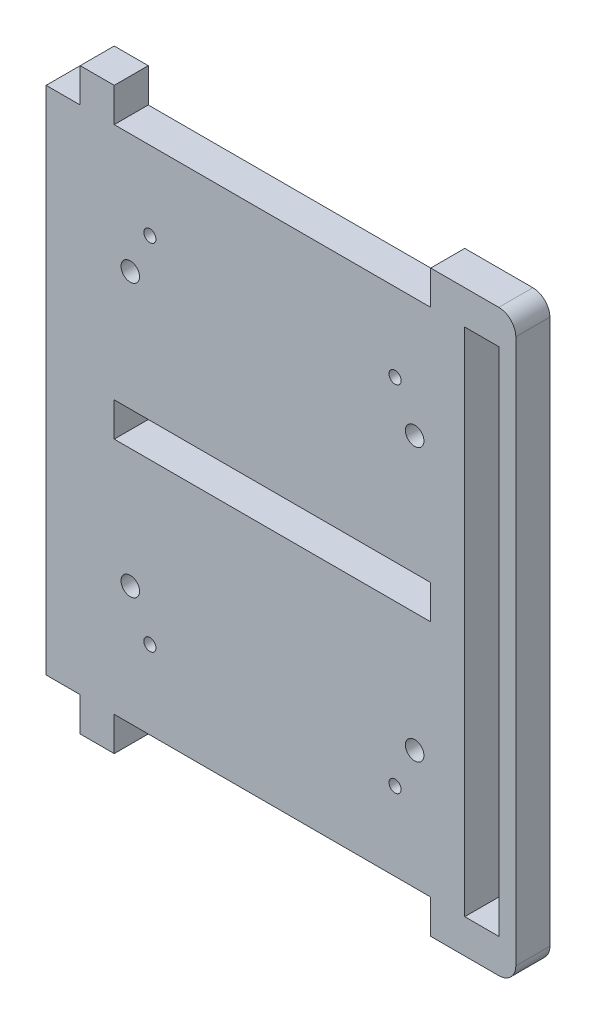
from build123d import *

# Parameters (mm, degrees)
SKETCH1_W                 = 59.0248375
SKETCH1_H                 = 6.35
SKETCH1_W_2               = 6.35
SKETCH1_H_2               = 95.25
BOSS_EXTRUDE1_DEPTH       = 6.35
TAP_DRILL_FOR_8_32_TAP4_D = 3.4544
TAP_DRILL_FOR_8_32_TAP5_D = 3.4544
TAP_DRILL_FOR_4_40_TAP1_D = 2.2606


with BuildPart() as part:
    # Sketch1 → Boss-Extrude1 (new body)
    with BuildSketch(Plane.XY):
        with BuildLine():
            Line((-36.4109, 0), (-30.0609, 0))
            Line((-30.0609, 0), (-30.0609, 6.35))
            Line((-30.0609, 6.35), (28.9639375, 6.35))
            Line((28.9639375, 6.35), (28.9639375, 0))
            Line((28.9639375, 0), (41.6639375, 0))
            ThreePointArc((41.6639375, 0), (43.90900153, 0.92993597), (44.8389375, 3.175))
            Line((44.8389375, 3.175), (44.8389375, 104.775))
            ThreePointArc((44.8389375, 104.775), (43.90900153, 107.02006403), (41.6639375, 107.95))
            Line((41.6639375, 107.95), (28.9639375, 107.95))
            Line((28.9639375, 107.95), (28.9639375, 101.6))
            Line((28.9639375, 101.6), (-30.0609, 101.6))
            Line((-30.0609, 101.6), (-30.0609, 107.95))
            Line((-30.0609, 107.95), (-36.4109, 107.95))
            Line((-36.4109, 107.95), (-36.4109, 101.6))
            Line((-36.4109, 101.6), (-42.7609, 101.6))
            Line((-42.7609, 101.6), (-42.7609, 6.35))
            Line((-42.7609, 6.35), (-36.4109, 6.35))
            Line((-36.4109, 6.35), (-36.4109, 0))
        make_face()
        with Locations((-0.54848125, 53.975)):
            Rectangle(SKETCH1_W, SKETCH1_H, mode=Mode.SUBTRACT)
        with Locations((38.4889375, 53.975)):
            Rectangle(SKETCH1_W_2, SKETCH1_H_2, mode=Mode.SUBTRACT)
    extrude(amount=BOSS_EXTRUDE1_DEPTH)

    # Tap Drill for #8-32 Tap4 (through all)
    with Locations(Plane(origin=(210.206342913, -81.87086846, 83.327875), x_dir=(1, 0, 0), z_dir=(0, 0, 1))):
        with Locations((-184.233255413, 161.24586846), (-184.233255413, 110.44586846), (-237.276392913, 110.44586846), (-237.276392913, 161.24586846)):
            Hole(TAP_DRILL_FOR_8_32_TAP4_D / 2)

    # Tap Drill for #8-32 Tap5 (through all)
    with Locations(Plane(origin=(210.206342913, -81.87086846, 6.35), x_dir=(1, 0, 0), z_dir=(0, 0, 1))):
        with Locations((-184.233255413, 161.24586846), (-184.233255413, 110.44586846), (-237.276392913, 110.44586846), (-237.276392913, 161.24586846)):
            Hole(TAP_DRILL_FOR_8_32_TAP5_D / 2)

    # Tap Drill for #4-40 Tap1 (through all)
    with Locations(Plane(origin=(210.206342913, -81.87086846, 0), x_dir=(-1, 0, 0), z_dir=(0, 0, -1))):
        with Locations((233.614824163, 168.86586846), (233.614824163, 102.82586846), (187.894824163, 102.82586846), (187.894824163, 168.86586846)):
            Hole(TAP_DRILL_FOR_4_40_TAP1_D / 2)


solid = part.part
